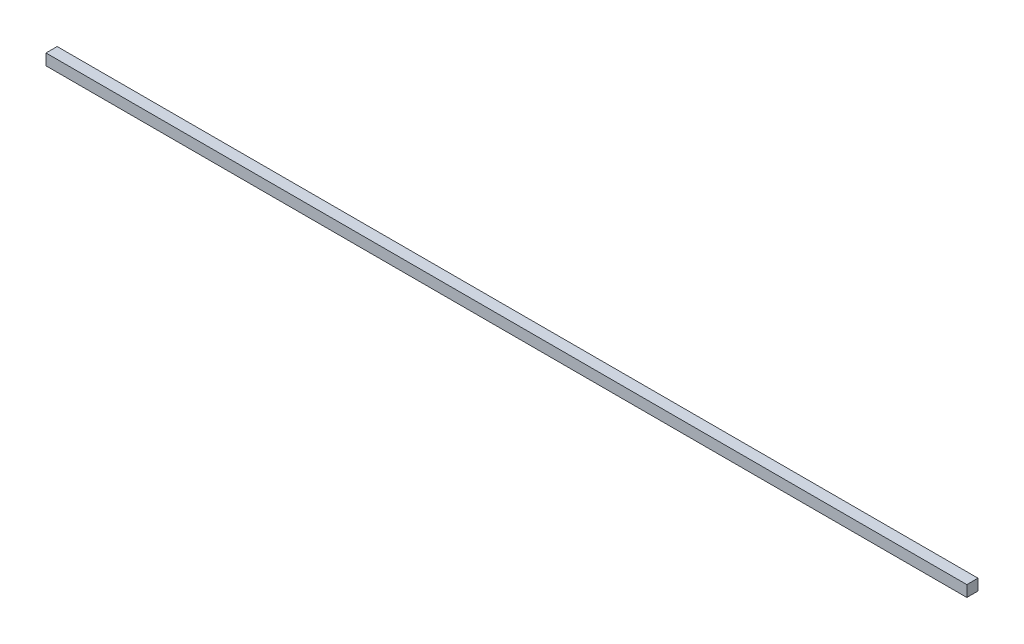
from build123d import *

# Parameters (mm, degrees)
SKETCH1_W           = 3.175
SKETCH1_H           = 3.175
BOSS_EXTRUDE1_DEPTH = 261.9375


with BuildPart() as part:
    # Sketch1 → Boss-Extrude1 (new body)
    with BuildSketch(Plane(origin=(1.5875, 0, 0), x_dir=(0, 0, -1), z_dir=(1, 0, 0))):
        with Locations((611.333553399, 20.136791701)):
            Rectangle(SKETCH1_W, SKETCH1_H)
    extrude(amount=BOSS_EXTRUDE1_DEPTH)


solid = part.part
